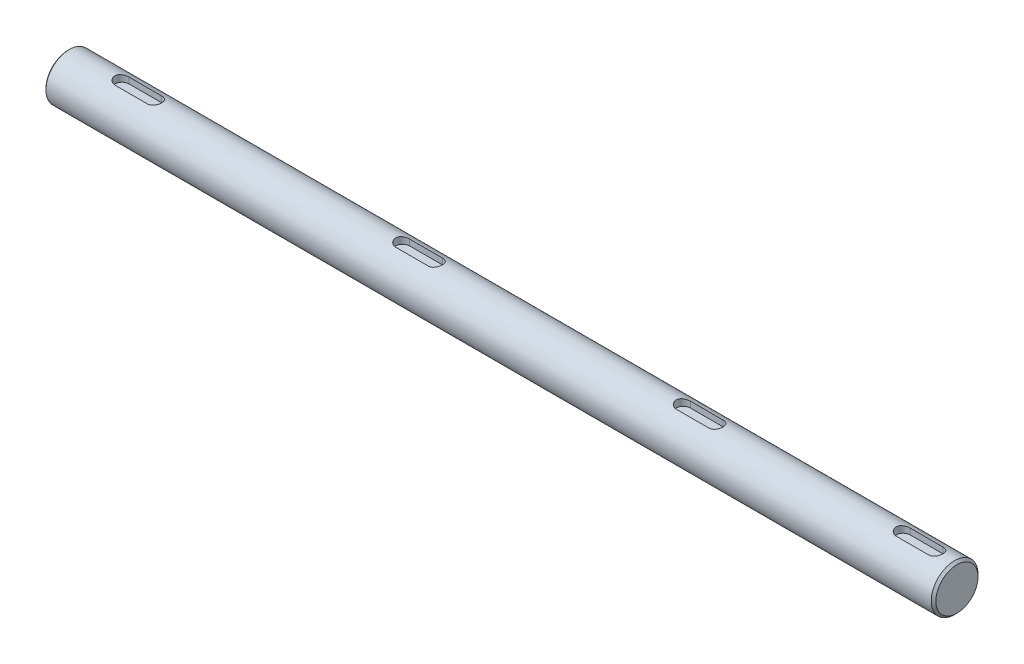
from build123d import *

# Parameters (mm, degrees)
SKETCH_1_R             = 10
EXTRUDE_1_DEPTH        = 300
CUT_EXTRUDE_1_DEPTH    = 3
CHAMFER_1_SIZE         = 0.5
CHAMFER_2_SIZE         = 0.5
PATTERN_LINEAR_1_COUNT = 3
PATTERN_LINEAR_1_PITCH = 120
EXTRUDE_START          = -10
SKETCH_3_R             = 10
EXTRUDE_2_DEPTH        = 110
CHAMFER_3_SIZE         = 1
CUT_EXTRUDE_2_DEPTH    = 60
CUT_EXTRUDE_START      = -20
SKETCH_5_R             = 10
CUT_EXTRUDE_3_DEPTH    = 20
CHAMFER_4_SIZE         = 1


with BuildPart() as part:
    # 草图1 → 凸台-拉伸1 (new body)
    with BuildSketch(Plane(origin=(0, 0, 0), x_dir=(0, 0, -1), z_dir=(1, 0, 0))):
        Circle(SKETCH_1_R)
    extrude(amount=EXTRUDE_1_DEPTH)

    # 草图2 → 切除-拉伸1 (cut)
    with BuildSketch(Plane(origin=(0, 10, 0), x_dir=(1, 0, 0), z_dir=(0, 1, 0))):
        with BuildLine():
            Line((263, 3), (277, 3))
            ThreePointArc((277, 3), (280, 0), (277, -3))
            Line((277, -3), (263, -3))
            ThreePointArc((263, -3), (260, 0), (263, 3))
        make_face()
    cut_extrude_1 = extrude(amount=-CUT_EXTRUDE_1_DEPTH, mode=Mode.SUBTRACT)

    # 倒角1
    chamfer_1_edges = [part.edges().sort_by_distance(p)[0] for p in [
        (0, 0, 10),
    ]]
    chamfer(chamfer_1_edges, length=CHAMFER_1_SIZE)

    # 倒角2
    chamfer_2_edges = [part.edges().sort_by_distance(p)[0] for p in [
        (300, 0, 10),
    ]]
    chamfer(chamfer_2_edges, length=CHAMFER_2_SIZE)

    # 阵列(线性)1: 切除-拉伸1 ×3
    with Locations(*[(-i * PATTERN_LINEAR_1_PITCH, 0, 0) for i in range(1, PATTERN_LINEAR_1_COUNT)]):
        add(cut_extrude_1, mode=Mode.SUBTRACT)

    # 草图3 → 凸台-拉伸2 (add)
    with BuildSketch(Plane(origin=(300, 0, 0), x_dir=(0, 0, -1), z_dir=(1, 0, 0)).offset(EXTRUDE_START)):
        Circle(SKETCH_3_R)
    extrude(amount=EXTRUDE_2_DEPTH)

    # 倒角3
    chamfer_3_edges = [part.edges().sort_by_distance(p)[0] for p in [
        (400, 0, 10),
    ]]
    chamfer(chamfer_3_edges, length=CHAMFER_3_SIZE)

    # 草图4 → 切除-拉伸2 (cut)
    with BuildSketch(Plane(origin=(0, 7, 0), x_dir=(1, 0, 0), z_dir=(0, 1, 0))):
        with BuildLine():
            Line((357, 3), (371, 3))
            ThreePointArc((371, 3), (374, 0), (371, -3))
            Line((371, -3), (357, -3))
            ThreePointArc((357, -3), (354, 0), (357, 3))
        make_face()
    extrude(amount=CUT_EXTRUDE_2_DEPTH, mode=Mode.SUBTRACT)

    # 草图5 → 切除-拉伸3 (cut)
    with BuildSketch(Plane(origin=(400, 0, 0), x_dir=(0, 0, -1), z_dir=(1, 0, 0)).offset(CUT_EXTRUDE_START)):
        Circle(SKETCH_5_R)
    extrude(amount=CUT_EXTRUDE_3_DEPTH, mode=Mode.SUBTRACT)

    # 倒角4
    chamfer_4_edges = [part.edges().sort_by_distance(p)[0] for p in [
        (380, 0, 10),
    ]]
    chamfer(chamfer_4_edges, length=CHAMFER_4_SIZE)


solid = part.part
